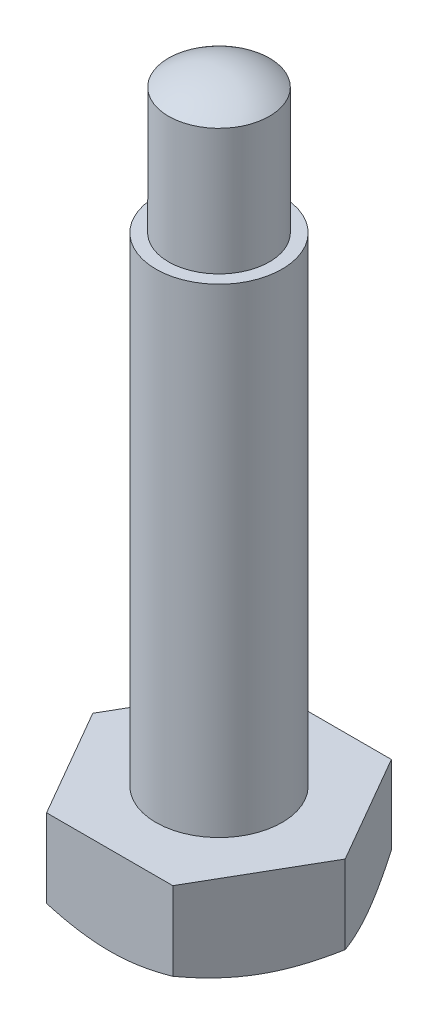
from build123d import *

# Parameters (mm, degrees)
SKETCH1_R           = 7.5
BOSS_EXTRUDE1_DEPTH = 10.5
SKETCH1_3_R         = 7.5
SKETCH1_3_R_2       = 6
BOSS_EXTRUDE2_DEPTH = 67.5
SKETCH1_4_R         = 6
BOSS_EXTRUDE3_DEPTH = 82.5
SKETCH4_OUTSIDE_W   = 336.484
SKETCH4_OUTSIDE_H   = 332.462
SKETCH4_OUTSIDE_R   = 13
CUT_EXTRUDE1_DEPTH  = 82.5
CUT_EXTRUDE1_DRAFT  = -60


with BuildPart() as part:
    # Sketch1 → Boss-Extrude1 (new body)
    with BuildSketch(Plane(origin=(0, 0, 0), x_dir=(1, 0, 0), z_dir=(0, 1, 0))):
        Polygon((15.011106999, 0), (7.505553499, 13), (-7.505553499, 13), (-15.011106999, 0), (-7.505553499, -13), (7.505553499, -13), align=None)
        with Locations(Location((0, 0, 0), (0, 0, 270))):
            Circle(SKETCH1_R, mode=Mode.SUBTRACT)
    extrude(amount=BOSS_EXTRUDE1_DEPTH)

    # Sketch1<3> → Boss-Extrude2 (add)
    with BuildSketch(Plane(origin=(0, 0, 0), x_dir=(1, 0, 0), z_dir=(0, 1, 0))):
        with Locations(Location((0, 0, 0), (0, 0, 270))):
            Circle(SKETCH1_3_R)
        with Locations(Location((0, 0, 0), (0, 0, 270))):
            Circle(SKETCH1_3_R_2, mode=Mode.SUBTRACT)
    extrude(amount=BOSS_EXTRUDE2_DEPTH)

    # Sketch1<4> → Boss-Extrude3 (add)
    with BuildSketch(Plane(origin=(0, 0, 0), x_dir=(1, 0, 0), z_dir=(0, 1, 0))):
        with Locations(Location((0, 0, 0), (0, 0, 270))):
            Circle(SKETCH1_4_R)
    extrude(amount=BOSS_EXTRUDE3_DEPTH)

    # Sketch2 → Revolve1 (revolve)
    with BuildSketch(Plane.XY):
        with BuildLine():
            Line((0, 82.5), (0, 84.5))
            ThreePointArc((0, 84.5), (-3.16227766, 83.986832981), (-6, 82.5))
            Line((-6, 82.5), (0, 82.5))
        make_face()
    revolve(axis=Axis((0, 82.5, 0), (0, 1, 0)))


with BuildPart() as cut_extrude1_tool:
    # Sketch4 outside → Cut-Extrude1 (with draft: the straight prism first)
    with BuildSketch(Plane.XZ):
        Rectangle(SKETCH4_OUTSIDE_W, SKETCH4_OUTSIDE_H)
        Circle(SKETCH4_OUTSIDE_R, mode=Mode.SUBTRACT)
    extrude(amount=-CUT_EXTRUDE1_DEPTH)
    # Cut-Extrude1: the draft: its side faces are tilted about the plane it starts from
    cut_extrude1_sides = [cut_extrude1_tool.faces().sort_by_distance(p)[0] for p in [
        (0, 41.25, -166.231),
        (168.242, 41.25, 0),
        (0, 41.25, 166.231),
        (-168.242, 41.25, 0),
        (-13, 41.25, 0),
    ]]
    draft(cut_extrude1_sides, Plane.XZ, CUT_EXTRUDE1_DRAFT)


with BuildPart() as part_1:
    add(part.part)

    # Cut-Extrude1: cut by cut_extrude1_tool
    add(cut_extrude1_tool.part, mode=Mode.SUBTRACT)


solid = part_1.part
